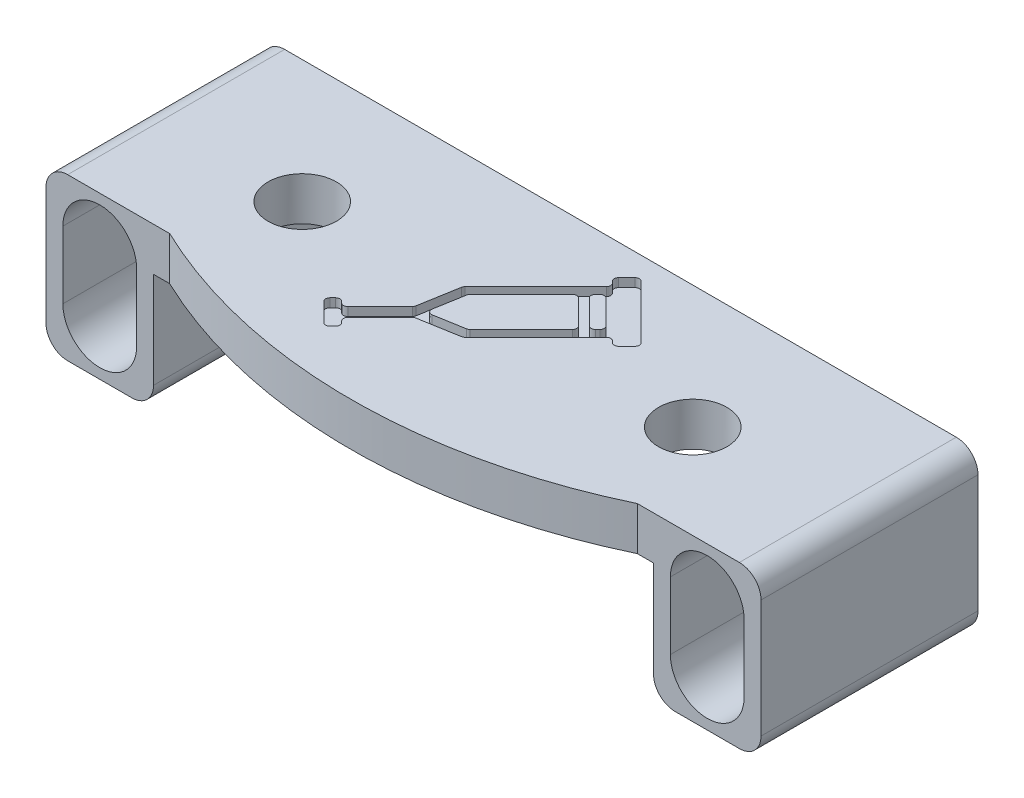
from build123d import *

# Parameters (mm, degrees)
SKETCH_1_W          = 27.112781954
SKETCH_1_H          = 9.518796992
SKETCH_1_R          = 1.575
EXTRUDE_1_DEPTH     = 2
SKETCH_2_W          = 27.112781954
SKETCH_2_H          = 2
EXTRUDE_2_DEPTH     = 0.91
CUT_EXTRUDE_1_DEPTH = 15.829626281
CUT_EXTRUDE_2_DEPTH = 17.785702449
EXTRUDE_3_DEPTH     = 10
SKETCH_8_R          = 1.575
CUT_EXTRUDE_3_DEPTH = 10
EXTRUDE_4_DEPTH     = 2
FILLET_2_R          = 1
CUT_EXTRUDE_4_DEPTH = 0.4


with BuildPart() as part:
    # Эскиз1 → Бобышка-Вытянуть1 (new body)
    with BuildSketch(Plane(origin=(0, 0, 0), x_dir=(1, 0, 0), z_dir=(0, 1, 0))):
        Rectangle(SKETCH_1_W, SKETCH_1_H)
        with Locations(Location((-9, 0, 0), (0, 0, 270))):
            Circle(SKETCH_1_R, mode=Mode.SUBTRACT)
        with Locations(Location((9, 0, 0), (0, 0, 270))):
            Circle(SKETCH_1_R, mode=Mode.SUBTRACT)
    extrude(amount=EXTRUDE_1_DEPTH)

    # Эскиз2 → Бобышка-Вытянуть2 (add)
    with BuildSketch(Plane(origin=(0, 0, -4.759398496), x_dir=(-1, 0, 0), z_dir=(0, 0, -1))):
        with Locations((0, 1)):
            Rectangle(SKETCH_2_W, SKETCH_2_H)
    extrude(amount=EXTRUDE_2_DEPTH)

    # Эскиз3 → Вырез-Вытянуть1 (cut, through all)
    with BuildSketch(Plane.XZ):
        Polygon((-6.720997268, 4.759398496), (-3, 5.765), (-14.556442119, 5.765), (-14.556442119, -5.765), (-3, -5.765), (-3.353751395, -5.669398496), (-13.556390977, -5.669398496), (-13.556390977, 4.759398496), align=None)
        with BuildLine():
            Line((-10.043565082, 3.861472766), (-6.720997268, 4.759398496))
            Line((-6.720997268, 4.759398496), (-13.556390977, 4.759398496))
            Line((-13.556390977, 4.759398496), (-13.556390977, -5.669398496))
            Line((-13.556390977, -5.669398496), (-3.353751395, -5.669398496))
            Line((-3.353751395, -5.669398496), (-10.043565082, -3.861472766))
            ThreePointArc((-10.043565082, -3.861472766), (-13, 0), (-10.043565082, 3.861472766))
        make_face()
        with BuildLine():
            Line((13.556390977, 4.759398496), (6.720997268, 4.759398496))
            Line((6.720997268, 4.759398496), (10.043565082, 3.861472766))
            ThreePointArc((10.043565082, 3.861472766), (12.17602427, 2.431639331), (13, 0))
            ThreePointArc((13, 0), (12.17602427, -2.431639331), (10.043565082, -3.861472766))
            Line((10.043565082, -3.861472766), (3.353751395, -5.669398496))
            Line((3.353751395, -5.669398496), (13.556390977, -5.669398496))
            Line((13.556390977, -5.669398496), (13.556390977, 4.759398496))
        make_face()
        Polygon((3, 5.765), (6.720997268, 4.759398496), (13.556390977, 4.759398496), (13.556390977, -5.669398496), (3.353751395, -5.669398496), (3, -5.765), (14.556442119, -5.765), (14.556442119, 5.765), align=None)
    extrude(amount=-CUT_EXTRUDE_1_DEPTH, mode=Mode.SUBTRACT)

    # Эскиз4 → Вырез-Вытянуть2 (cut, through all)
    with BuildSketch(Plane(origin=(0, 0, -5.669398496), x_dir=(-1, 0, 0), z_dir=(0, 0, -1))):
        Polygon((11.521782541, 2), (11.521782541, -6.403006286), (13.618299284, -6.403006286), (13.618299284, 3.686124148), (11.521782541, 3.686124148), align=None)
        Polygon((-13.618299284, -6.403006286), (-11.521782541, -6.403006286), (-11.521782541, 2), (-11.521782541, 3.686124148), (-13.618299284, 3.686124148), align=None)
    extrude(amount=-CUT_EXTRUDE_2_DEPTH, mode=Mode.SUBTRACT)

    # Эскиз7 → Бобышка-Вытянуть3 (add)
    with BuildSketch(Plane(origin=(0, 0, -5.669398496), x_dir=(-1, 0, 0), z_dir=(0, 0, -1))):
        Polygon((3.353751395, 0), (11.521782541, 0), (11.521782541, -5.430586026), (16.478217459, -5.430586026), (16.478217459, 2), (11.521782541, 2), (3.353751395, 2), align=None)
        with BuildLine():
            Line((15.7, -3.265293013), (15.7, -0.165293013))
            ThreePointArc((15.7, -0.165293013), (14, 1.534706987), (12.3, -0.165293013))
            Line((12.3, -0.165293013), (12.3, -3.265293013))
            ThreePointArc((12.3, -3.265293013), (14, -4.965293013), (15.7, -3.265293013))
        make_face(mode=Mode.SUBTRACT)
    extrude_3 = extrude(amount=-EXTRUDE_3_DEPTH)

    # Эскиз8 → Вырез-Вытянуть3 (cut)
    with BuildSketch(Plane(origin=(0, 2, 0), x_dir=(1, 0, 0), z_dir=(0, 1, 0))):
        with Locations(Location((-9, 0, 0), (0, 0, 270))):
            Circle(SKETCH_8_R)
    cut_extrude_3 = extrude(amount=-CUT_EXTRUDE_3_DEPTH, mode=Mode.SUBTRACT)

    # Зеркальное отражение1: Бобышка-Вытянуть3, Вырез-Вытянуть3 across plane
    add(extrude_3.mirror(Plane(origin=(0, 0, 0), x_dir=(0, 0, 1), z_dir=(1, 0, 0))))
    add(cut_extrude_3.mirror(Plane(origin=(0, 0, 0), x_dir=(0, 0, 1), z_dir=(1, 0, 0))), mode=Mode.SUBTRACT)

    # Эскиз9 → Бобышка-Вытянуть4 (add)
    with BuildSketch(Plane(origin=(0, 2, 0), x_dir=(1, 0, 0), z_dir=(0, 1, 0))):
        with BuildLine():
            Line((6.720997268, -4.759398496), (-6.720997268, -4.759398496))
            Line((-6.720997268, -4.759398496), (-8.307661997, -4.330601504))
            Line((-8.307661997, -4.330601504), (-10.777839616, -4.330601504))
            ThreePointArc((-10.777839616, -4.330601504), (0, -6.773159867), (10.777839616, -4.330601504))
            Line((10.777839616, -4.330601504), (8.307661997, -4.330601504))
            Line((8.307661997, -4.330601504), (6.720997268, -4.759398496))
        make_face()
    extrude(amount=-EXTRUDE_4_DEPTH)

    # Скругление2
    fillet_2_edges = [part.edges().sort_by_distance(p)[0] for p in [
        (-16.478217459, 2, -0.669398496),
        (-16.478217459, -5.430586026, -0.669398496),
        (-11.521782541, -5.430586026, -0.669398496),
        (11.521782541, -5.430586026, -0.669398496),
        (16.478217459, -5.430586026, -0.669398496),
        (16.478217459, 2, -0.669398496),
    ]]
    fillet(fillet_2_edges, radius=FILLET_2_R)

    # Эскиз12 → Вырез-Вытянуть4 (cut)
    with BuildSketch(Plane(origin=(0, 2, 0), x_dir=(1, 0, 0), z_dir=(0, 1, 0))):
        with BuildLine():
            Line((4.446560813, 2.176089775), (1.988755362, 4.633895225))
            ThreePointArc((1.988755362, 4.633895225), (1.847334006, 4.692473869), (1.70591265, 4.633895225))
            Line((1.70591265, 4.633895225), (1.327376273, 4.255358849))
            ThreePointArc((1.327376273, 4.255358849), (1.268797629, 4.113937492), (1.327376273, 3.972516136))
            Line((1.327376273, 3.972516136), (1.402795262, 3.897097148))
            ThreePointArc((1.402795262, 3.897097148), (1.461373905, 3.755675791), (1.402795262, 3.614254435))
            Line((1.402795262, 3.614254435), (-1.852293326, 0.359165847))
            ThreePointArc((-1.852293326, 0.359165847), (-1.888439649, 0.309775569), (-1.907956953, 0.25176668))
            Line((-1.907956953, 0.25176668), (-2.218358166, -1.546336835))
            ThreePointArc((-2.218358166, -1.546336835), (-2.23787547, -1.604345724), (-2.274021793, -1.653736003))
            Line((-2.274021793, -1.653736003), (-3.75824321, -3.13795742))
            ThreePointArc((-3.75824321, -3.13795742), (-3.899664566, -3.196536063), (-4.041085922, -3.13795742))
            Line((-4.041085922, -3.13795742), (-4.109500023, -3.069543319))
            ThreePointArc((-4.109500023, -3.069543319), (-4.250921379, -3.010964675), (-4.392342735, -3.069543319))
            Line((-4.392342735, -3.069543319), (-4.522380617, -3.1995812))
            ThreePointArc((-4.522380617, -3.1995812), (-4.58095926, -3.341002556), (-4.522380617, -3.482423913))
            Line((-4.522380617, -3.482423913), (-3.669758325, -4.335046204))
            ThreePointArc((-3.669758325, -4.335046204), (-3.528336969, -4.393624848), (-3.386915613, -4.335046204))
            Line((-3.386915613, -4.335046204), (-3.256877732, -4.205008323))
            ThreePointArc((-3.256877732, -4.205008323), (-3.198299088, -4.063586966), (-3.256877732, -3.92216561))
            Line((-3.256877732, -3.92216561), (-3.325291832, -3.853751509))
            ThreePointArc((-3.325291832, -3.853751509), (-3.383870476, -3.712330153), (-3.325291832, -3.570908797))
            Line((-3.325291832, -3.570908797), (-1.841070415, -2.08668738))
            ThreePointArc((-1.841070415, -2.08668738), (-1.791680137, -2.050541057), (-1.733671248, -2.031023753))
            Line((-1.733671248, -2.031023753), (0.064432267, -1.720622541))
            ThreePointArc((0.064432267, -1.720622541), (0.122441156, -1.701105237), (0.171831435, -1.664958913))
            Line((0.171831435, -1.664958913), (3.426920022, 1.590129674))
            ThreePointArc((3.426920022, 1.590129674), (3.568341379, 1.648708318), (3.709762735, 1.590129674))
            Line((3.709762735, 1.590129674), (3.785181724, 1.514710686))
            ThreePointArc((3.785181724, 1.514710686), (3.92660308, 1.456132042), (4.068024436, 1.514710686))
            Line((4.068024436, 1.514710686), (4.446560813, 1.893247062))
            ThreePointArc((4.446560813, 1.893247062), (4.505139456, 2.034668419), (4.446560813, 2.176089775))
        make_face()
        with BuildLine():
            Line((2.963799211, 2.036003209), (1.848668796, 3.151133624))
            ThreePointArc((1.848668796, 3.151133624), (1.70724744, 3.209712267), (1.565826084, 3.151133624))
            Line((1.565826084, 3.151133624), (1.465360653, 3.050668193))
            ThreePointArc((1.465360653, 3.050668193), (1.406782009, 2.909246836), (1.465360653, 2.76782548))
            Line((1.465360653, 2.76782548), (2.580491067, 1.652695065))
            ThreePointArc((2.580491067, 1.652695065), (2.721912424, 1.594116422), (2.86333378, 1.652695065))
            Line((2.86333378, 1.652695065), (2.963799211, 1.753160497))
            ThreePointArc((2.963799211, 1.753160497), (3.022377855, 1.894581853), (2.963799211, 2.036003209))
        make_face(mode=Mode.SUBTRACT)
        with BuildLine():
            Line((2.334078689, 1.406282687), (1.218948275, 2.521413102))
            ThreePointArc((1.218948275, 2.521413102), (1.077526918, 2.579991746), (0.936105562, 2.521413102))
            Line((0.936105562, 2.521413102), (-1.42428076, 0.16102678))
            ThreePointArc((-1.42428076, 0.16102678), (-1.460427083, 0.111636501), (-1.479944387, 0.053627613))
            Line((-1.479944387, 0.053627613), (-1.712610446, -1.294168861))
            ThreePointArc((-1.712610446, -1.294168861), (-1.656946819, -1.469612406), (-1.481503274, -1.525276034))
            Line((-1.481503274, -1.525276034), (-0.1337068, -1.292609974))
            ThreePointArc((-0.1337068, -1.292609974), (-0.075697911, -1.27309267), (-0.026307633, -1.236946347))
            Line((-0.026307633, -1.236946347), (2.334078689, 1.123439975))
            ThreePointArc((2.334078689, 1.123439975), (2.392657333, 1.264861331), (2.334078689, 1.406282687))
        make_face(mode=Mode.SUBTRACT)
    extrude(amount=-CUT_EXTRUDE_4_DEPTH, mode=Mode.SUBTRACT)


solid = part.part
